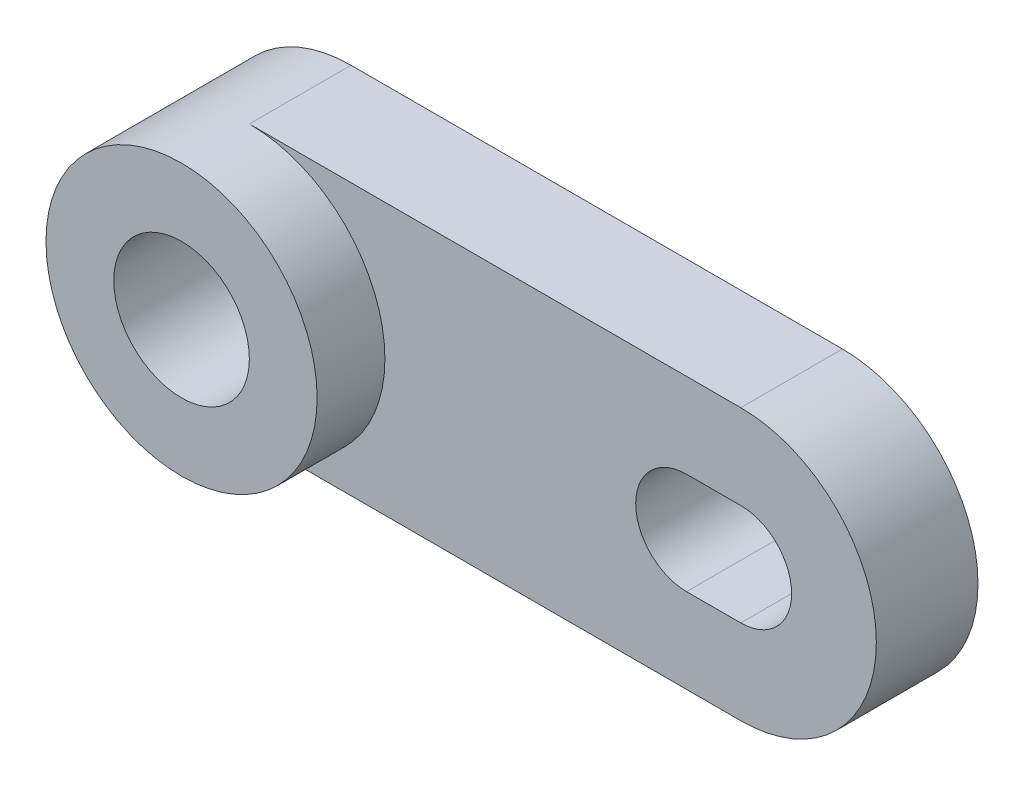
from build123d import *

# Parameters (mm, degrees)
CROQUIS1_R              = 4
CROQUIS1_R_2            = 2
SALIENTE_EXTRUIR1_DEPTH = 3
CROQUIS2_R              = 4
CROQUIS2_R_2            = 2
SALIENTE_EXTRUIR2_DEPTH = 2
CROQUIS3_R              = 2.5
CORTAR_EXTRUIR1_DEPTH   = 2


with BuildPart() as part:
    # Croquis1 → Saliente-Extruir1 (new body)
    # profile 1 of 3: a face of its own
    with BuildSketch(Plane.XY):
        Circle(CROQUIS1_R)
        Circle(CROQUIS1_R_2, mode=Mode.SUBTRACT)
    # profile 2 of 3: a face of its own
    with BuildSketch(Plane.XY):
        with BuildLine():
            Line((14.5, 4), (0, 4))
            ThreePointArc((0, 4), (2.828427125, 2.828427125), (4, 0))
            ThreePointArc((4, 0), (2.828427125, -2.828427125), (0, -4))
            Line((0, -4), (14.5, -4))
            ThreePointArc((14.5, -4), (10.5, 0), (14.5, 4))
        make_face()
    # profile 3 of 3: a face of its own
    with BuildSketch(Plane.XY):
        with BuildLine():
            ThreePointArc((18.5, 0), (17.328427125, 2.828427125), (14.5, 4))
            ThreePointArc((14.5, 4), (10.5, 0), (14.5, -4))
            ThreePointArc((14.5, -4), (17.328427125, -2.828427125), (18.5, 0))
        make_face()
        with BuildLine():
            Line((14.5, -1.5), (12.9, -1.5))
            ThreePointArc((12.9, -1.5), (11.4, 0), (12.9, 1.5))
            Line((12.9, 1.5), (14.5, 1.5))
            ThreePointArc((14.5, 1.5), (15.560660172, 1.060660172), (16, 0))
            ThreePointArc((16, 0), (15.560660172, -1.060660172), (14.5, -1.5))
        make_face(mode=Mode.SUBTRACT)
    extrude(amount=SALIENTE_EXTRUIR1_DEPTH)

    # Croquis2 → Saliente-Extruir2 (add)
    with BuildSketch(Plane.XY.offset(3)):
        with Locations(Location((0, 0, 0), (0, 0, 270))):
            Circle(CROQUIS2_R)
        Circle(CROQUIS2_R_2, mode=Mode.SUBTRACT)
    extrude(amount=SALIENTE_EXTRUIR2_DEPTH)

    # Croquis3 → Cortar-Extruir1 (cut)
    with BuildSketch(Plane(origin=(0, 0, 0), x_dir=(-1, 0, 0), z_dir=(0, 0, -1))):
        Circle(CROQUIS3_R)
    extrude(amount=-CORTAR_EXTRUIR1_DEPTH, mode=Mode.SUBTRACT)


solid = part.part
